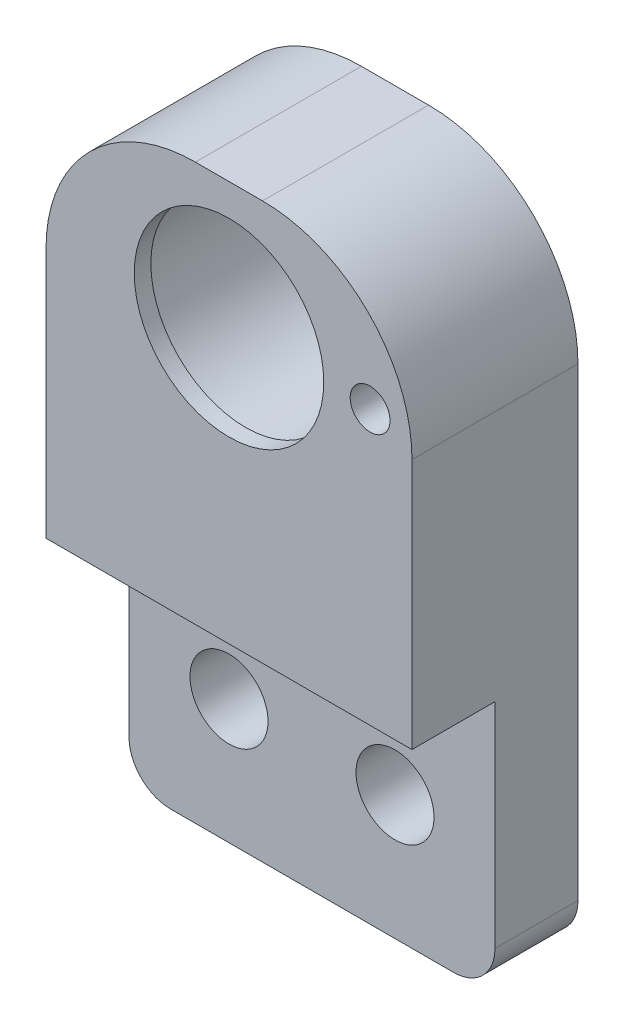
from build123d import *

# Parameters (mm, degrees)
SKETCH1_R           = 7.9248
SKETCH1_R_2         = 1.524
SKETCH1_R_3         = 2.9845
SKETCH1_R_4         = 7.250000001
BOSS_EXTRUDE1_DEPTH = 12.7
SKETCH1_3_R         = 7.9248
SKETCH1_3_R_2       = 7.250000001
CUT_EXTRUDE1_DEPTH  = 11.43
CUT_EXTRUDE2_START  = 6.35
SKETCH1_4_R         = 2.9845
CUT_EXTRUDE2_DEPTH  = 6.35


with BuildPart() as part:
    # Sketch1 → Boss-Extrude1 (new body)
    # profile 1 of 3: a face of its own
    with BuildSketch(Plane.XY):
        with BuildLine():
            Line((32.856445179, 105.449695346), (32.856445179, 86.239695346))
            Line((32.856445179, 86.239695346), (60.856445178, 86.239695346))
            Line((60.856445178, 86.239695346), (60.856445178, 105.449695346))
            ThreePointArc((60.856445178, 105.449695346), (57.508675687, 113.531925855), (49.426445178, 116.879695346))
            Line((49.426445178, 116.879695346), (44.286445179, 116.879695346))
            ThreePointArc((44.286445179, 116.879695346), (36.20421467, 113.531925855), (32.856445179, 105.449695346))
        make_face()
        with Locations((46.856445179, 107.196695347)):
            Circle(SKETCH1_R, mode=Mode.SUBTRACT)
        with Locations((57.651445179, 107.196695347)):
            Circle(SKETCH1_R_2, mode=Mode.SUBTRACT)
    # profile 2 of 3: a face of its own
    with BuildSketch(Plane.XY):
        with BuildLine():
            ThreePointArc((32.856445179, 69.889695346), (33.786381148, 67.644631316), (36.031445179, 66.714695346))
            Line((36.031445179, 66.714695346), (57.681445178, 66.714695346))
            ThreePointArc((57.681445178, 66.714695346), (59.926509208, 67.644631316), (60.856445178, 69.889695346))
            Line((60.856445178, 69.889695346), (60.856445178, 86.239695346))
            Line((60.856445178, 86.239695346), (32.856445179, 86.239695346))
            Line((32.856445179, 86.239695346), (32.856445179, 69.889695346))
        make_face()
        with Locations((40.506445179, 76.239695346)):
            Circle(SKETCH1_R_3, mode=Mode.SUBTRACT)
        with Locations((53.206445179, 76.239695346)):
            Circle(SKETCH1_R_3, mode=Mode.SUBTRACT)
    # profile 3 of 3: a face of its own
    with BuildSketch(Plane.XY):
        with Locations((46.856445179, 107.196695347)):
            Circle(SKETCH1_R)
        with Locations((46.856445179, 107.196695347)):
            Circle(SKETCH1_R_4, mode=Mode.SUBTRACT)
    extrude(amount=BOSS_EXTRUDE1_DEPTH)

    # Sketch1<3> → Cut-Extrude1 (cut)
    with BuildSketch(Plane.XY):
        with Locations((46.856445179, 107.196695347)):
            Circle(SKETCH1_3_R)
        with Locations((46.856445179, 107.196695347)):
            Circle(SKETCH1_3_R_2, mode=Mode.SUBTRACT)
    extrude(amount=CUT_EXTRUDE1_DEPTH, mode=Mode.SUBTRACT)

    # Sketch1<4> → Cut-Extrude2 (cut)
    with BuildSketch(Plane.XY.offset(CUT_EXTRUDE2_START)):
        with BuildLine():
            ThreePointArc((32.856445179, 69.889695346), (33.786381148, 67.644631316), (36.031445179, 66.714695346))
            Line((36.031445179, 66.714695346), (57.681445178, 66.714695346))
            ThreePointArc((57.681445178, 66.714695346), (59.926509208, 67.644631316), (60.856445178, 69.889695346))
            Line((60.856445178, 69.889695346), (60.856445178, 86.239695346))
            Line((60.856445178, 86.239695346), (32.856445179, 86.239695346))
            Line((32.856445179, 86.239695346), (32.856445179, 69.889695346))
        make_face()
        with Locations((40.506445179, 76.239695346)):
            Circle(SKETCH1_4_R, mode=Mode.SUBTRACT)
        with Locations((53.206445179, 76.239695346)):
            Circle(SKETCH1_4_R, mode=Mode.SUBTRACT)
    extrude(amount=CUT_EXTRUDE2_DEPTH, mode=Mode.SUBTRACT)


solid = part.part
